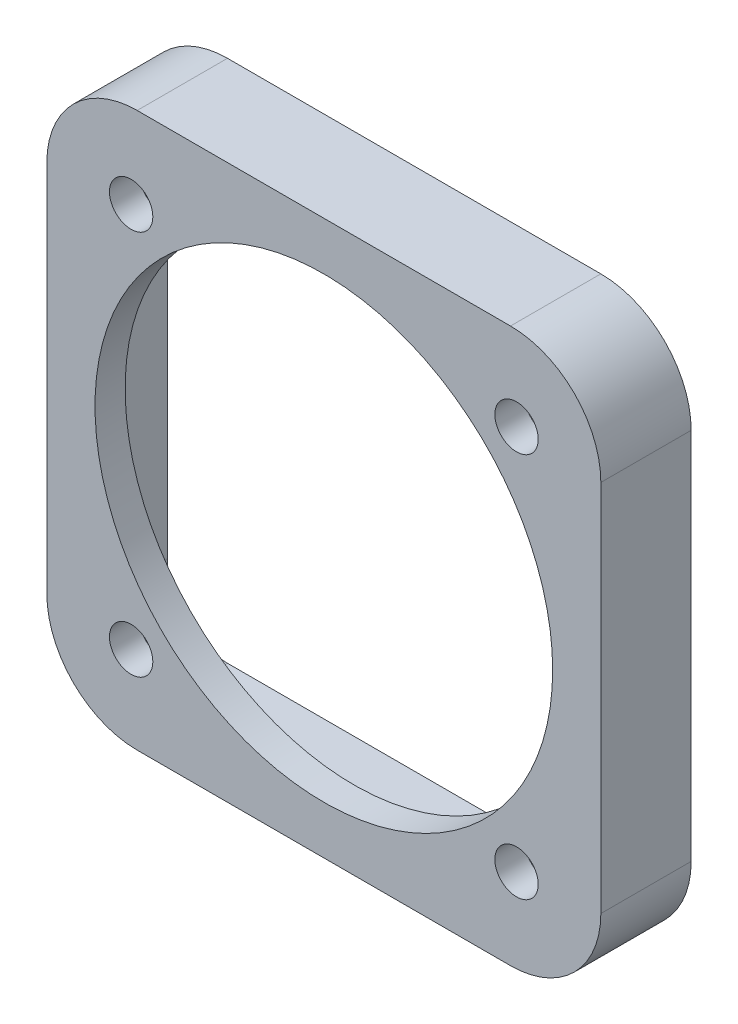
from build123d import *

# Parameters (mm, degrees)
BOSS_EXTRUDE2_DEPTH  = 2.5
BOSS_EXTRUDE3_START  = 5
BOSS_EXTRUDE3_DEPTH  = 5
M3_CLEARANCE_HOLE1_D = 3.6


with BuildPart() as part:
    # Sketch2 → Boss-Extrude2 (new body)
    # profile 1 of 2: a face of its own
    with BuildSketch(Plane.XY.offset(-2000)):
        with BuildLine():
            Line((102.89897186, 166.585877116), (133.89897186, 166.585877116))
            ThreePointArc((133.89897186, 166.585877116), (139.202272719, 164.389177975), (141.39897186, 159.085877116))
            Line((141.39897186, 159.085877116), (141.39897186, 138.785877116))
            Line((141.39897186, 138.785877116), (141.39897186, 135.685877116))
            Line((141.39897186, 135.685877116), (141.39897186, 135.385877116))
            Line((141.39897186, 135.385877116), (141.39897186, 133.385877116))
            Line((141.39897186, 133.385877116), (141.39897186, 133.085877116))
            Line((141.39897186, 133.085877116), (141.39897186, 131.333076667))
            Line((141.39897186, 131.333076667), (141.39897186, 128.085877116))
            ThreePointArc((141.39897186, 128.085877116), (139.202272719, 122.782576257), (133.89897186, 120.585877116))
            Line((133.89897186, 120.585877116), (102.89897186, 120.585877116))
            ThreePointArc((102.89897186, 120.585877116), (97.595671001, 122.782576257), (95.39897186, 128.085877116))
            Line((95.39897186, 128.085877116), (95.39897186, 159.085877116))
            ThreePointArc((95.39897186, 159.085877116), (97.595671001, 164.389177975), (102.89897186, 166.585877116))
        make_face()
        with BuildLine():
            ThreePointArc((138.89897186, 159.085877116), (137.434505766, 162.621411022), (133.89897186, 164.085877116))
            Line((133.89897186, 164.085877116), (102.89897186, 164.085877116))
            ThreePointArc((102.89897186, 164.085877116), (99.363437954, 162.621411022), (97.89897186, 159.085877116))
            Line((97.89897186, 159.085877116), (97.89897186, 128.085877116))
            ThreePointArc((97.89897186, 128.085877116), (99.363437954, 124.55034321), (102.89897186, 123.085877116))
            Line((102.89897186, 123.085877116), (133.89897186, 123.085877116))
            ThreePointArc((133.89897186, 123.085877116), (137.434505766, 124.55034321), (138.89897186, 128.085877116))
            Line((138.89897186, 128.085877116), (138.89897186, 131.333076667))
            Line((138.89897186, 131.333076667), (138.89897186, 133.085877116))
            Line((138.89897186, 133.085877116), (138.89897186, 133.385877116))
            Line((138.89897186, 133.385877116), (138.89897186, 135.385877116))
            Line((138.89897186, 135.385877116), (138.89897186, 135.685877116))
            Line((138.89897186, 135.685877116), (138.89897186, 138.785877116))
            Line((138.89897186, 138.785877116), (138.89897186, 159.085877116))
        make_face(mode=Mode.SUBTRACT)
    # profile 2 of 2: a face of its own
    with BuildSketch(Plane.XY.offset(-2000)):
        with BuildLine():
            Line((138.89897186, 135.685877116), (138.89897186, 138.785877116))
            Line((138.89897186, 138.785877116), (138.89897186, 159.085877116))
            ThreePointArc((138.89897186, 159.085877116), (137.434505766, 162.621411022), (133.89897186, 164.085877116))
            Line((133.89897186, 164.085877116), (102.89897186, 164.085877116))
            ThreePointArc((102.89897186, 164.085877116), (99.363437954, 162.621411022), (97.89897186, 159.085877116))
            Line((97.89897186, 159.085877116), (97.89897186, 128.085877116))
            ThreePointArc((97.89897186, 128.085877116), (99.363437954, 124.55034321), (102.89897186, 123.085877116))
            Line((102.89897186, 123.085877116), (133.89897186, 123.085877116))
            ThreePointArc((133.89897186, 123.085877116), (137.434505766, 124.55034321), (138.89897186, 128.085877116))
            Line((138.89897186, 128.085877116), (138.89897186, 131.333076667))
            Line((138.89897186, 131.333076667), (138.89897186, 133.085877116))
            Line((138.89897186, 133.085877116), (138.89897186, 133.385877116))
            Line((138.89897186, 133.385877116), (138.89897186, 135.385877116))
            Line((138.89897186, 135.385877116), (138.89897186, 135.685877116))
        make_face()
        with BuildLine():
            ThreePointArc((99.460267487, 142.060925747), (99.432576344, 142.456345732), (99.413140247, 142.85225734))
            ThreePointArc((99.413140247, 142.85225734), (99.62769877, 146.525146856), (100.54610998, 150.087824725))
            ThreePointArc((100.54610998, 150.087824725), (102.540191704, 154.050058497), (105.398627834, 157.441960805))
            ThreePointArc((105.398627834, 157.441960805), (125.948589847, 161.021566614), (137.39897186, 143.585877116))
            ThreePointArc((137.39897186, 143.585877116), (123.543114722, 125.295502757), (102.184467206, 133.681845673))
            ThreePointArc((102.184467206, 133.681845673), (100.329957721, 137.711293892), (99.460267487, 142.060925747))
        make_face(mode=Mode.SUBTRACT)
    extrude(amount=BOSS_EXTRUDE2_DEPTH)

    # Sketch4 → Boss-Extrude3 (add)
    with BuildSketch(Plane(origin=(0, 0, -2000), x_dir=(-1, 0, 0), z_dir=(0, 0, -1)).offset(BOSS_EXTRUDE3_START)):
        with BuildLine():
            Line((-102.89897186, 166.585877116), (-133.89897186, 166.585877116))
            ThreePointArc((-133.89897186, 166.585877116), (-139.202272719, 164.389177975), (-141.39897186, 159.085877116))
            Line((-141.39897186, 159.085877116), (-141.39897186, 128.085877116))
            ThreePointArc((-141.39897186, 128.085877116), (-139.202272719, 122.782576257), (-133.89897186, 120.585877116))
            Line((-133.89897186, 120.585877116), (-102.89897186, 120.585877116))
            ThreePointArc((-102.89897186, 120.585877116), (-97.595671001, 122.782576257), (-95.39897186, 128.085877116))
            Line((-95.39897186, 128.085877116), (-95.39897186, 159.085877116))
            ThreePointArc((-95.39897186, 159.085877116), (-97.595671001, 164.389177975), (-102.89897186, 166.585877116))
        make_face()
        with BuildLine():
            Line((-102.89897186, 164.085877116), (-133.89897186, 164.085877116))
            ThreePointArc((-133.89897186, 164.085877116), (-137.434505766, 162.621411022), (-138.89897186, 159.085877116))
            Line((-138.89897186, 159.085877116), (-138.89897186, 128.085877116))
            ThreePointArc((-138.89897186, 128.085877116), (-137.434505766, 124.55034321), (-133.89897186, 123.085877116))
            Line((-133.89897186, 123.085877116), (-102.89897186, 123.085877116))
            ThreePointArc((-102.89897186, 123.085877116), (-99.363437954, 124.55034321), (-97.89897186, 128.085877116))
            Line((-97.89897186, 128.085877116), (-97.89897186, 159.085877116))
            ThreePointArc((-97.89897186, 159.085877116), (-99.363437954, 162.621411022), (-102.89897186, 164.085877116))
        make_face(mode=Mode.SUBTRACT)
    extrude(amount=-BOSS_EXTRUDE3_DEPTH)

    # M3 Clearance Hole1 (through all)
    with Locations(Plane.XY.offset(-1997.5)):
        with Locations((102.39897186, 159.585877116), (102.39897186, 127.585877116), (134.39897186, 127.585877116), (134.39897186, 159.585877116)):
            Hole(M3_CLEARANCE_HOLE1_D / 2)


solid = part.part
